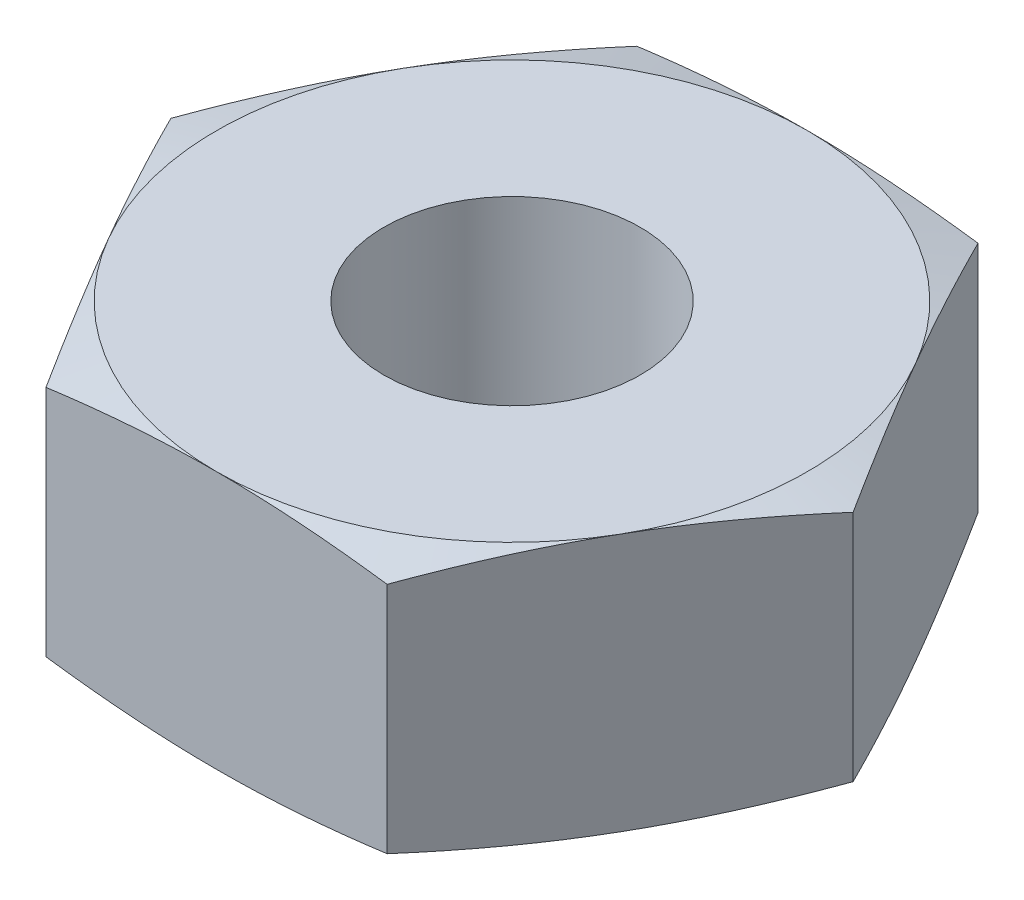
from build123d import *

# Parameters (mm, degrees)
EXTRUDE1_DEPTH = 1.2
SKETCH3_R      = 1.193
EXTRUDE2_DEPTH = 5.837957558


with BuildPart() as part:
    # Sketch1 → Extrude1 (new, symmetric)
    with BuildSketch(Plane(origin=(0, 0, 0), x_dir=(1, 0, 0), z_dir=(0, 1, 0))):
        Polygon((3.175426481, 0), (1.58771324, 2.75), (-1.58771324, 2.75), (-3.175426481, 0), (-1.58771324, -2.75), (1.58771324, -2.75), align=None)
    extrude(amount=EXTRUDE1_DEPTH, both=True)

    # Sketch2 → Cut-Revolve1 (revolve, cut)
    with BuildSketch(Plane(origin=(0, 0, 0), x_dir=(0, 0, -1), z_dir=(1, 0, 0))):
        Polygon((-2.75, 1.2), (-77.780239009, -18.90429195), (-77.780239009, 1.2), align=None)
    cut_revolve1 = revolve(axis=Axis((0, 0, 0), (0, 1, 0)), mode=Mode.SUBTRACT)

    # Mirror1: Cut-Revolve1 across plane
    add(cut_revolve1.mirror(Plane.ZX), mode=Mode.SUBTRACT)

    # Sketch3 → Extrude2 (cut, through all)
    with BuildSketch(Plane(origin=(0, 1.2, 0), x_dir=(1, 0, 0), z_dir=(0, 1, 0))):
        with Locations(Location((0, 0, 0), (0, 0, 270))):
            Circle(SKETCH3_R)
    extrude(amount=-EXTRUDE2_DEPTH, mode=Mode.SUBTRACT)


solid = part.part
